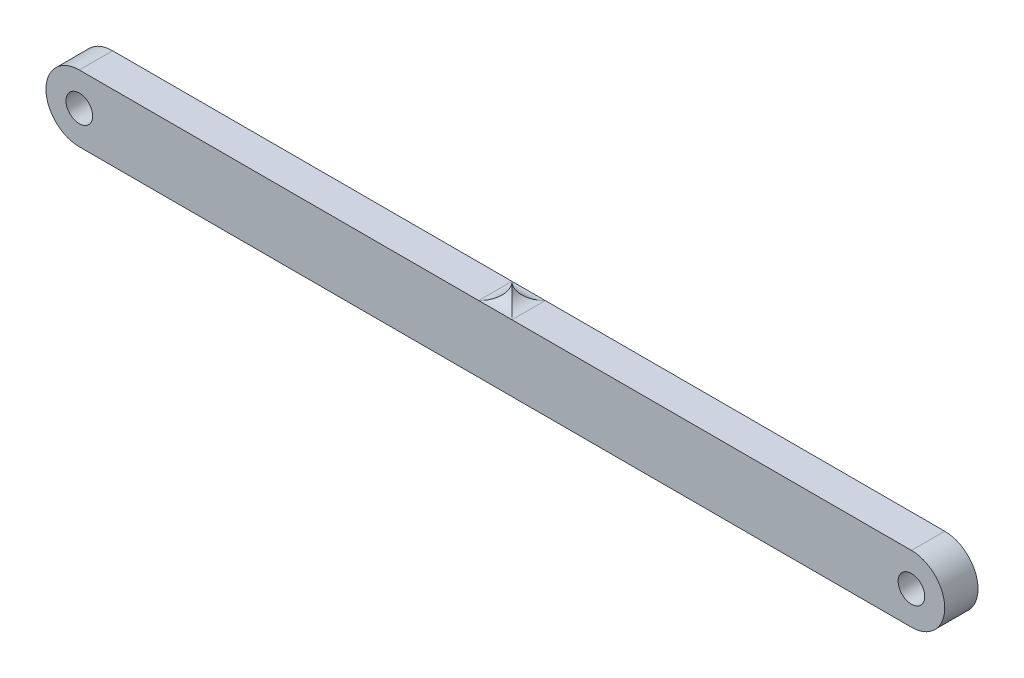
from build123d import *

# Parameters (mm, degrees)
BOSS_EXTRUDE1_DEPTH     = 5
F_8_0MM_DOWEL_HOLE1_D   = 8
BOSS_EXTRUDE2_DEPTH     = 10
CUT_EXTRUDE1_DEPTH      = 136.922772191
CUT_EXTRUDE1_DEPTH_BACK = 136.922772191


with BuildPart() as part:
    # Sketch1 → Boss-Extrude1 (new, symmetric)
    with BuildSketch(Plane.XY):
        with BuildLine():
            Line((-125, 10), (125, 10))
            ThreePointArc((125, 10), (135, 0), (125, -10))
            Line((125, -10), (-125, -10))
            ThreePointArc((-125, -10), (-135, 0), (-125, 10))
        make_face()
    extrude(amount=BOSS_EXTRUDE1_DEPTH, both=True)

    # Ø8.0mm Dowel Hole1 (through all)
    with Locations(Plane.XY.offset(5)):
        with Locations((-125, 0), (125, 0)):
            Hole(F_8_0MM_DOWEL_HOLE1_D / 2)

    # Sketch4 → Boss-Extrude2 (add)
    with BuildSketch(Plane.XY.offset(5)):
        with BuildLine():
            Line((-5, 10), (5, 10))
            ThreePointArc((5, 10), (1.464466094, 11.464466094), (0, 15))
            ThreePointArc((0, 15), (-1.464466094, 11.464466094), (-5, 10))
        make_face()
    extrude(amount=-BOSS_EXTRUDE2_DEPTH)

    # Sketch5 → Cut-Extrude1 (cut, two sides: drawn at the far end of the back side and taken through both)
    with BuildSketch(Plane(origin=(0, 0, 0), x_dir=(0, 0, -1), z_dir=(1, 0, 0)).offset(-CUT_EXTRUDE1_DEPTH_BACK)):
        with BuildLine():
            Line((-5, 10), (-5, 20))
            Line((-5, 20), (5, 20))
            Line((5, 20), (5, 10))
            ThreePointArc((5, 10), (1.464466094, 11.464466094), (0, 15))
            ThreePointArc((0, 15), (-1.464466094, 11.464466094), (-5, 10))
        make_face()
    extrude(amount=CUT_EXTRUDE1_DEPTH + CUT_EXTRUDE1_DEPTH_BACK, mode=Mode.SUBTRACT)


solid = part.part
